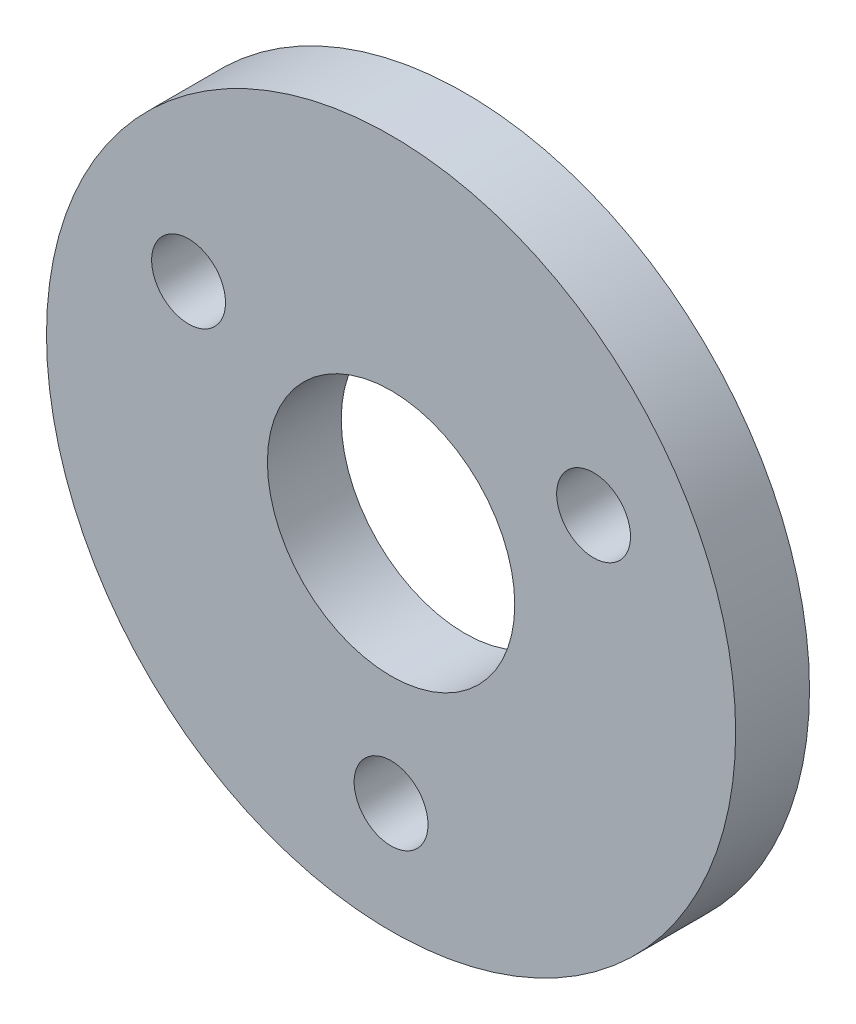
from build123d import *

# Parameters (mm, degrees)
SKETCH_1_R      = 14
SKETCH_1_R_2    = 5.025
SKETCH_1_R_3    = 1.5
EXTRUDE_1_DEPTH = 3


with BuildPart() as part:
    # 草图1 → 凸台-拉伸1 (new body)
    with BuildSketch(Plane.XY):
        Circle(SKETCH_1_R)
        Circle(SKETCH_1_R_2, mode=Mode.SUBTRACT)
        with Locations((0, -9.5)):
            Circle(SKETCH_1_R_3, mode=Mode.SUBTRACT)
        with Locations((-8.227241336, 4.75)):
            Circle(SKETCH_1_R_3, mode=Mode.SUBTRACT)
        with Locations((8.227241336, 4.75)):
            Circle(SKETCH_1_R_3, mode=Mode.SUBTRACT)
    extrude(amount=EXTRUDE_1_DEPTH)


solid = part.part
